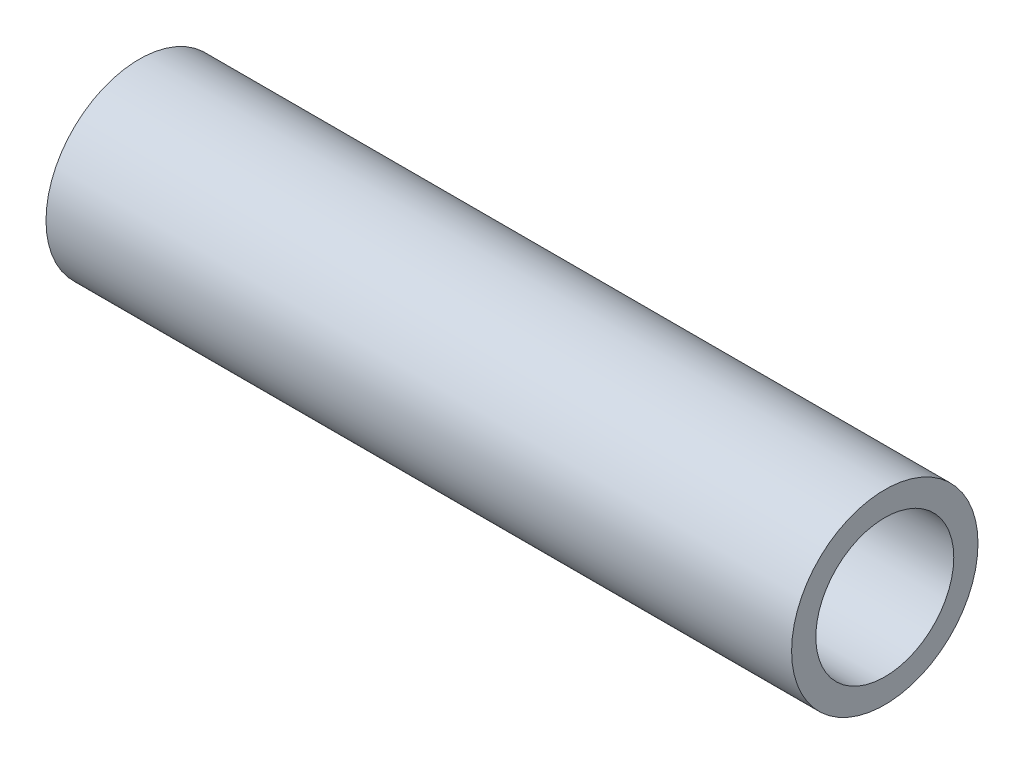
from build123d import *

# Parameters (mm, degrees)
SKETCH1_R           = 6.35
SKETCH1_R_2         = 4.699
BOSS_EXTRUDE1_DEPTH = 25.4


with BuildPart() as part:
    # Sketch1 → Boss-Extrude1 (new, symmetric)
    with BuildSketch(Plane(origin=(0, 0, 0), x_dir=(0, 0, -1), z_dir=(1, 0, 0))):
        Circle(SKETCH1_R)
        Circle(SKETCH1_R_2, mode=Mode.SUBTRACT)
    extrude(amount=BOSS_EXTRUDE1_DEPTH, both=True)


solid = part.part
